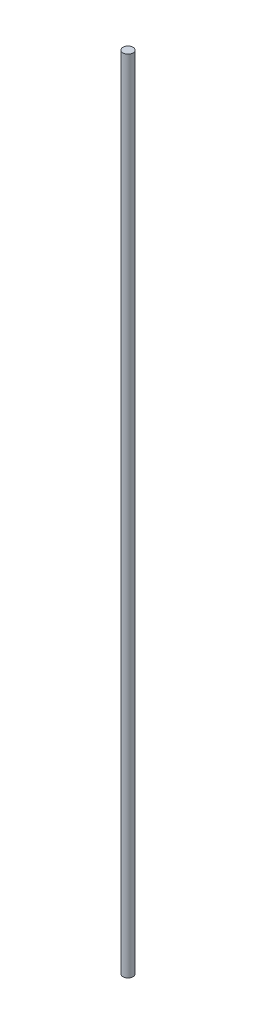
from build123d import *

# Parameters (mm, degrees)
SKETCH_1_R      = 0.5
EXTRUDE_1_DEPTH = 80


with BuildPart() as part:
    # 草图1 → 凸台-拉伸1 (new body)
    with BuildSketch(Plane(origin=(0, 0, 0), x_dir=(1, 0, 0), z_dir=(0, 1, 0))):
        with Locations(Location((0, 0, 0), (0, 0, 270))):
            Circle(SKETCH_1_R)
    extrude(amount=EXTRUDE_1_DEPTH)


solid = part.part
